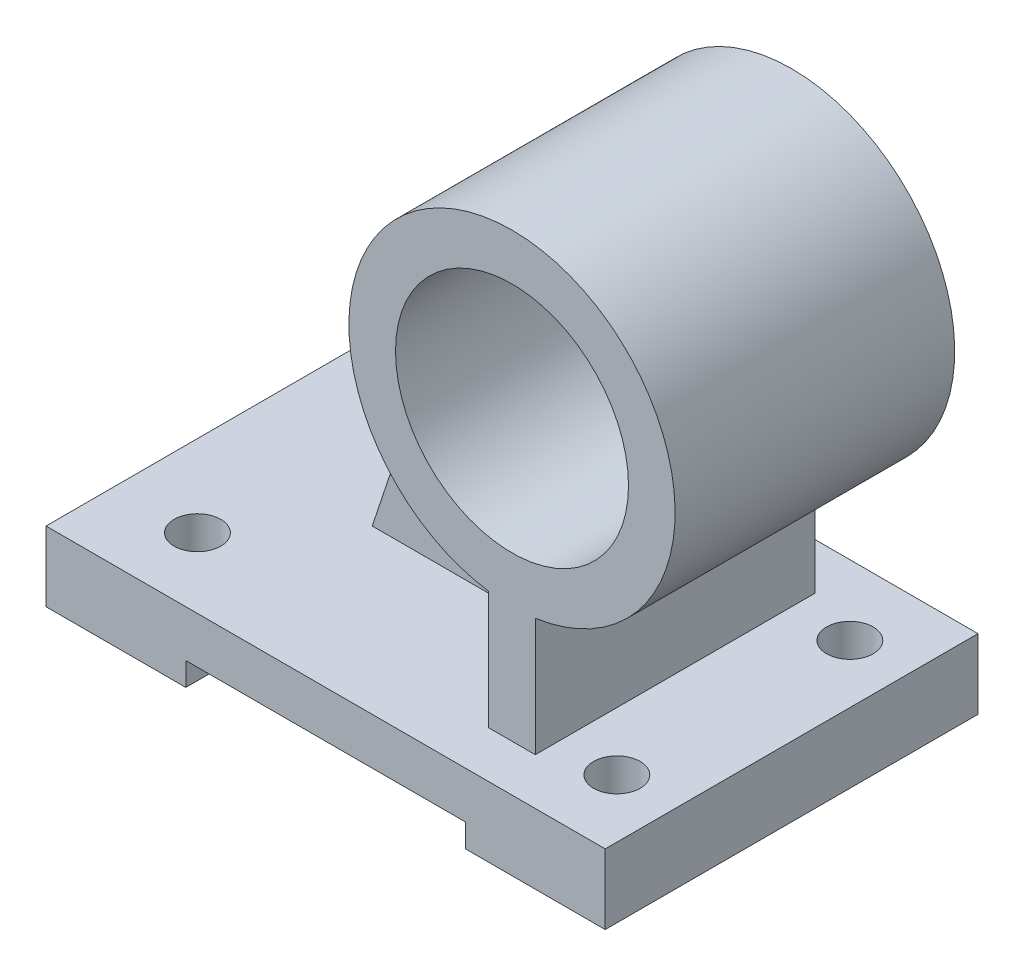
from build123d import *

# Parameters (mm, degrees)
BOSS_EXTRUDE1_DEPTH      = 30
BOSS_EXTRUDE1_DEPTH_BACK = 30
SKETCH1_R                = 25
BOSS_EXTRUDE2_DEPTH      = 5
BOSS_EXTRUDE2_DEPTH_BACK = 5
BOSS_EXTRUDE3_DEPTH      = 40
BOSS_EXTRUDE3_DEPTH_BACK = 40
SKETCH2_R                = 5
CUT_EXTRUDE1_DEPTH       = 40


with BuildPart() as part:
    # Sketch1 → Boss-Extrude1 (new, two sides: drawn at the far end of the back side and taken through both)
    with BuildSketch(Plane.XY.offset(-BOSS_EXTRUDE1_DEPTH_BACK)):
        with BuildLine():
            Line((-5, -34.641016151), (-5, -60))
            Line((-5, -60), (0, -60))
            Line((0, -60), (5, -60))
            Line((5, -60), (5, -34.641016151))
            ThreePointArc((5, -34.641016151), (22.912878475, 26.457513111), (-35, 0))
            ThreePointArc((-35, 0), (-26.457513111, -22.912878475), (-5, -34.641016151))
        make_face()
        Circle(SKETCH1_R, mode=Mode.SUBTRACT)
    extrude(amount=BOSS_EXTRUDE1_DEPTH + BOSS_EXTRUDE1_DEPTH_BACK)

    # Sketch1<5> → Boss-Extrude2 (add, two sides: drawn at the far end of the back side and taken through both)
    with BuildSketch(Plane.XY.offset(-BOSS_EXTRUDE2_DEPTH_BACK)):
        with BuildLine():
            Line((-55, -60), (-5, -60))
            Line((-5, -60), (-5, -34.641016151))
            ThreePointArc((-5, -34.641016151), (-26.457513111, -22.912878475), (-35, 0))
            Line((-35, 0), (-55, -60))
        make_face()
    extrude(amount=BOSS_EXTRUDE2_DEPTH + BOSS_EXTRUDE2_DEPTH_BACK)

    # Sketch1<6> → Boss-Extrude3 (add, two sides: drawn at the far end of the back side and taken through both)
    with BuildSketch(Plane.XY.offset(-BOSS_EXTRUDE3_DEPTH_BACK)):
        Polygon((0, -60), (-5, -60), (-55, -60), (-90, -60), (-90, -75), (-60, -75), (-60, -70), (0, -70), (0, -75), (30, -75), (30, -60), (5, -60), align=None)
    extrude(amount=BOSS_EXTRUDE3_DEPTH + BOSS_EXTRUDE3_DEPTH_BACK)

    # Sketch2 → Cut-Extrude1 (cut)
    with BuildSketch(Plane(origin=(0, -60, 0), x_dir=(1, 0, 0), z_dir=(0, 1, 0))):
        with Locations((-72.5, 25)):
            Circle(SKETCH2_R)
        with Locations((17.5, 25)):
            Circle(SKETCH2_R)
        with Locations((17.5, -25)):
            Circle(SKETCH2_R)
        with Locations((-72.5, -25)):
            Circle(SKETCH2_R)
    extrude(amount=-CUT_EXTRUDE1_DEPTH, mode=Mode.SUBTRACT)


solid = part.part
